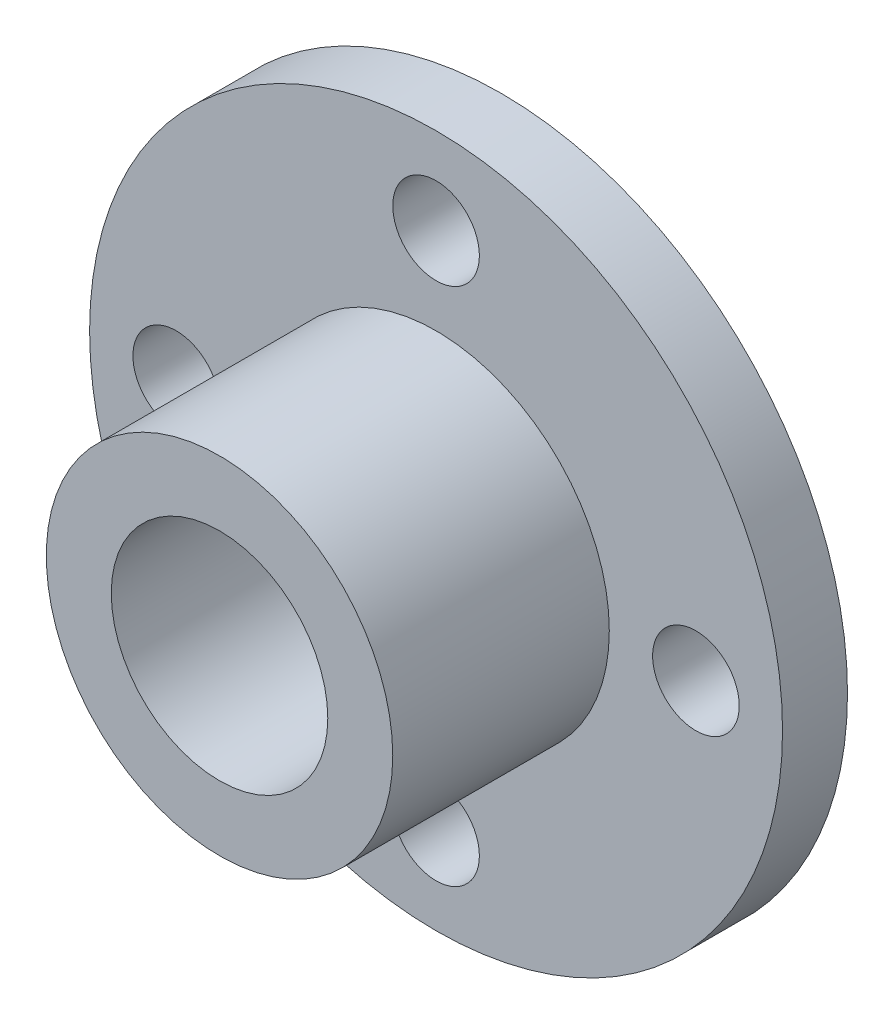
from build123d import *

# Parameters (mm, degrees)
SKETCH_1_R          = 16
EXTRUDE_1_DEPTH     = 3
SKETCH_2_R          = 8
EXTRUDE_2_DEPTH     = 10
CUT_EXTRUDE_1_REACH = 28.096
SKETCH_3_R          = 5
SKETCH_3_R_2        = 2


with BuildPart() as part:
    # 草图1 → 凸台-拉伸1 (new body)
    with BuildSketch(Plane.XY):
        Circle(SKETCH_1_R)
    extrude(amount=EXTRUDE_1_DEPTH)

    # 草图2 → 凸台-拉伸2 (add)
    with BuildSketch(Plane.XY.offset(3)):
        Circle(SKETCH_2_R)
    extrude(amount=EXTRUDE_2_DEPTH)

    # 草图3 → 切除-拉伸1 (cut, up to next)
    with BuildSketch(Plane.XY.offset(13), mode=Mode.PRIVATE) as cut_extrude_1_sk1:
        Circle(SKETCH_3_R)
    cut_extrude_1_tool1 = extrude(cut_extrude_1_sk1.sketch, amount=-CUT_EXTRUDE_1_REACH, mode=Mode.PRIVATE) & part.part
    # 草图3 → 切除-拉伸1 (cut, up to next)
    with BuildSketch(Plane.XY.offset(13), mode=Mode.PRIVATE) as cut_extrude_1_sk2:
        with Locations((0, 12)):
            Circle(SKETCH_3_R_2)
    cut_extrude_1_tool2 = extrude(cut_extrude_1_sk2.sketch, amount=-CUT_EXTRUDE_1_REACH, mode=Mode.PRIVATE) & part.part
    # 草图3 → 切除-拉伸1 (cut, up to next)
    with BuildSketch(Plane.XY.offset(13), mode=Mode.PRIVATE) as cut_extrude_1_sk3:
        with Locations((12, 0)):
            Circle(SKETCH_3_R_2)
    cut_extrude_1_tool3 = extrude(cut_extrude_1_sk3.sketch, amount=-CUT_EXTRUDE_1_REACH, mode=Mode.PRIVATE) & part.part
    # 草图3 → 切除-拉伸1 (cut, up to next)
    with BuildSketch(Plane.XY.offset(13), mode=Mode.PRIVATE) as cut_extrude_1_sk4:
        with Locations((0, -12)):
            Circle(SKETCH_3_R_2)
    cut_extrude_1_tool4 = extrude(cut_extrude_1_sk4.sketch, amount=-CUT_EXTRUDE_1_REACH, mode=Mode.PRIVATE) & part.part
    # 草图3 → 切除-拉伸1 (cut, up to next)
    with BuildSketch(Plane.XY.offset(13), mode=Mode.PRIVATE) as cut_extrude_1_sk5:
        with Locations((-12, 0)):
            Circle(SKETCH_3_R_2)
    cut_extrude_1_tool5 = extrude(cut_extrude_1_sk5.sketch, amount=-CUT_EXTRUDE_1_REACH, mode=Mode.PRIVATE) & part.part
    add(cut_extrude_1_tool1.solids().sort_by_distance((0, 0, 13))[0], mode=Mode.SUBTRACT)
    add(cut_extrude_1_tool2.solids().sort_by_distance((0, 12, 13))[0], mode=Mode.SUBTRACT)
    add(cut_extrude_1_tool3.solids().sort_by_distance((12, 0, 13))[0], mode=Mode.SUBTRACT)
    add(cut_extrude_1_tool4.solids().sort_by_distance((0, -12, 13))[0], mode=Mode.SUBTRACT)
    add(cut_extrude_1_tool5.solids().sort_by_distance((-12, 0, 13))[0], mode=Mode.SUBTRACT)


solid = part.part
